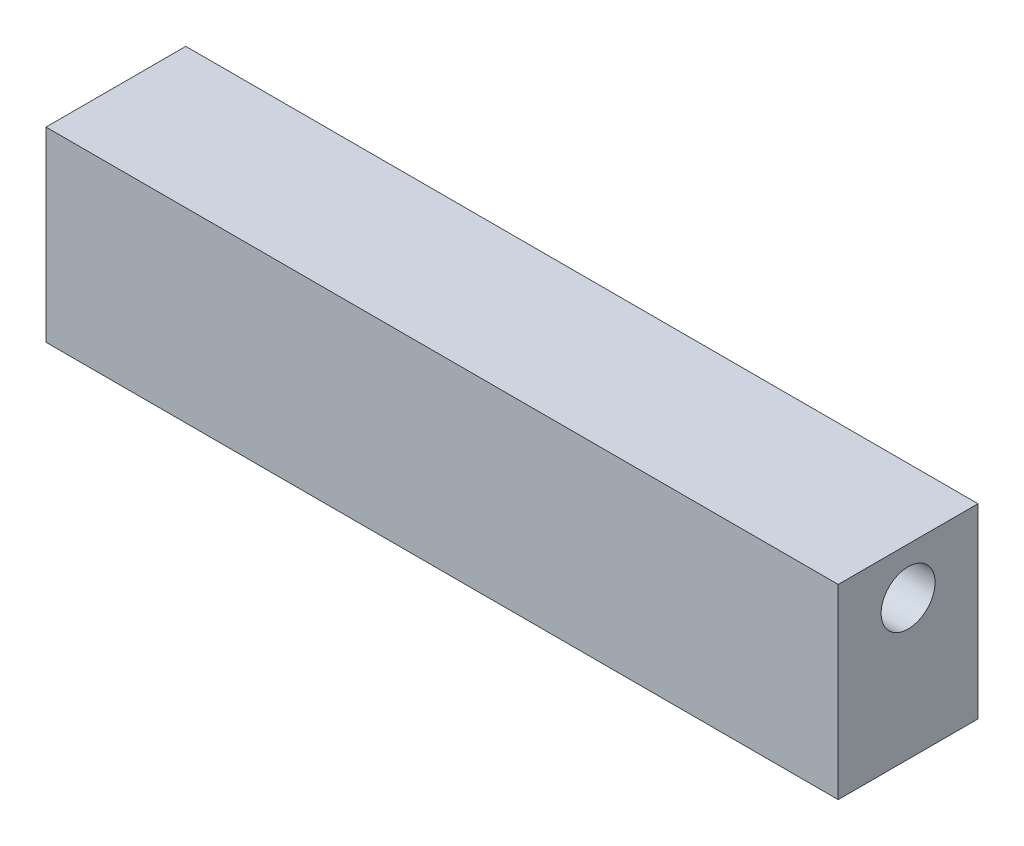
from build123d import *

# Parameters (mm, degrees)
SKETCH2_W           = 170
SKETCH2_H           = 30
BOSS_EXTRUDE1_DEPTH = 40
SKETCH3_W           = 150
SKETCH3_H           = 10
CUT_EXTRUDE1_DEPTH  = 20
SKETCH4_R           = 5.789067321
CUT_EXTRUDE2_DEPTH  = 170


with BuildPart() as part:
    # Sketch2 → Boss-Extrude1 (new body)
    with BuildSketch(Plane(origin=(0, 0, 0), x_dir=(1, 0, 0), z_dir=(0, 1, 0))):
        with Locations((85, 15)):
            Rectangle(SKETCH2_W, SKETCH2_H)
    extrude(amount=BOSS_EXTRUDE1_DEPTH)

    # Sketch3 → Cut-Extrude1 (cut)
    with BuildSketch(Plane.XZ):
        with Locations((85, -15)):
            Rectangle(SKETCH3_W, SKETCH3_H)
    extrude(amount=-CUT_EXTRUDE1_DEPTH, mode=Mode.SUBTRACT)

    # Sketch4 → Cut-Extrude2 (cut)
    with BuildSketch(Plane(origin=(170, 0, 0), x_dir=(0, 0, -1), z_dir=(1, 0, 0))):
        with Locations((15, 30)):
            Circle(SKETCH4_R)
    extrude(amount=-CUT_EXTRUDE2_DEPTH, mode=Mode.SUBTRACT)


solid = part.part
